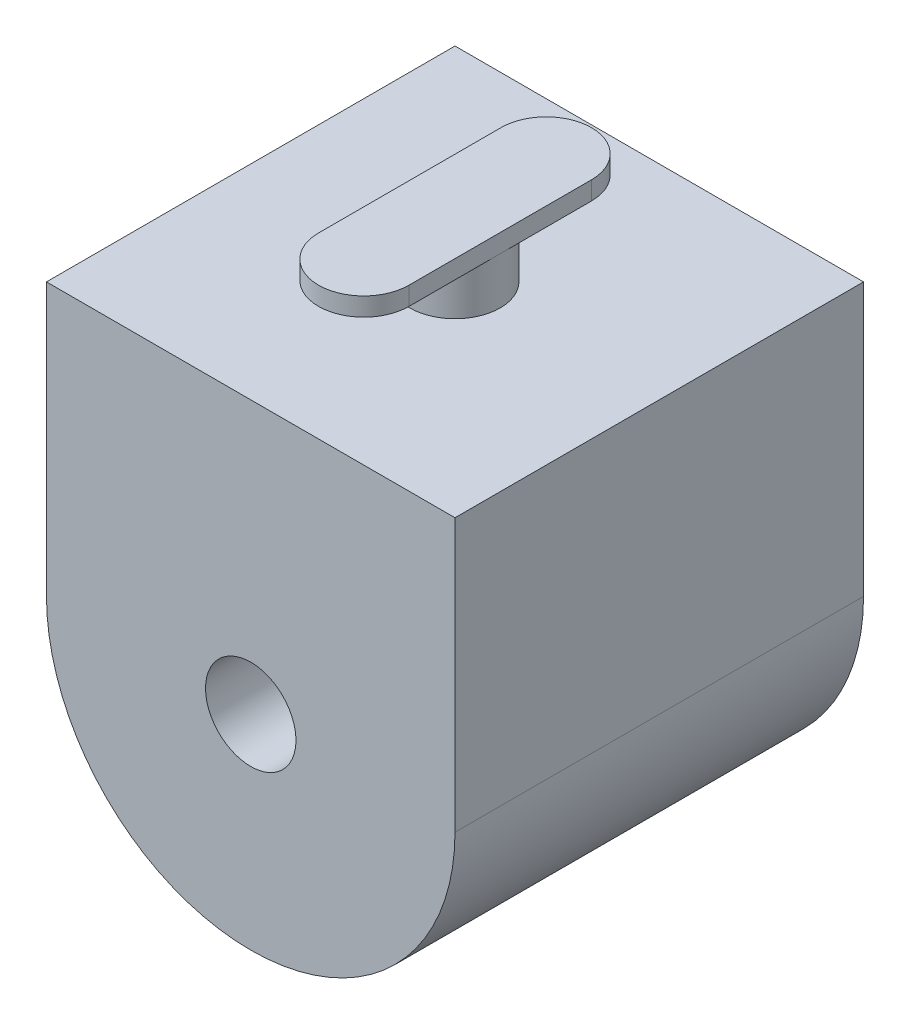
from build123d import *

# Parameters (mm, degrees)
BOSS_EXTRUDE1_DEPTH = 38.1
SKETCH2_R           = 4.2164
CUT_EXTRUDE1_DEPTH  = 38.1
SKETCH3_R           = 4.2164
BOSS_EXTRUDE2_DEPTH = 6.096
BOSS_EXTRUDE3_DEPTH = 1.7145


with BuildPart() as part:
    # Sketch1 → Boss-Extrude1 (new body)
    with BuildSketch(Plane.XY):
        with BuildLine():
            Line((-19.05, -12.7), (-19.05, 12.7))
            Line((-19.05, 12.7), (19.05, 12.7))
            Line((19.05, 12.7), (19.05, -12.7))
            ThreePointArc((19.05, -12.7), (0, -31.75), (-19.05, -12.7))
        make_face()
    extrude(amount=BOSS_EXTRUDE1_DEPTH)

    # Sketch2 → Cut-Extrude1 (cut)
    with BuildSketch(Plane(origin=(0, 0, 0), x_dir=(-1, 0, 0), z_dir=(0, 0, -1))):
        with Locations((0, -12.7)):
            Circle(SKETCH2_R)
    extrude(amount=-CUT_EXTRUDE1_DEPTH, mode=Mode.SUBTRACT)

    # Sketch3 → Boss-Extrude2 (add)
    with BuildSketch(Plane(origin=(0, 12.7, 0), x_dir=(1, 0, 0), z_dir=(0, 1, 0))):
        with Locations(Location((0, -19.05, 0), (0, 0, 90))):
            Circle(SKETCH3_R)
    extrude(amount=BOSS_EXTRUDE2_DEPTH)

    # Sketch4 → Boss-Extrude3 (add)
    with BuildSketch(Plane(origin=(0, 18.796, 0), x_dir=(1, 0, 0), z_dir=(0, 1, 0))):
        with BuildLine():
            Line((-4.2164, -27.559), (-4.2164, -10.541))
            ThreePointArc((-4.2164, -10.541), (0, -6.3246), (4.2164, -10.541))
            Line((4.2164, -10.541), (4.2164, -27.559))
            ThreePointArc((4.2164, -27.559), (0, -31.7754), (-4.2164, -27.559))
        make_face()
    extrude(amount=-BOSS_EXTRUDE3_DEPTH)


solid = part.part
